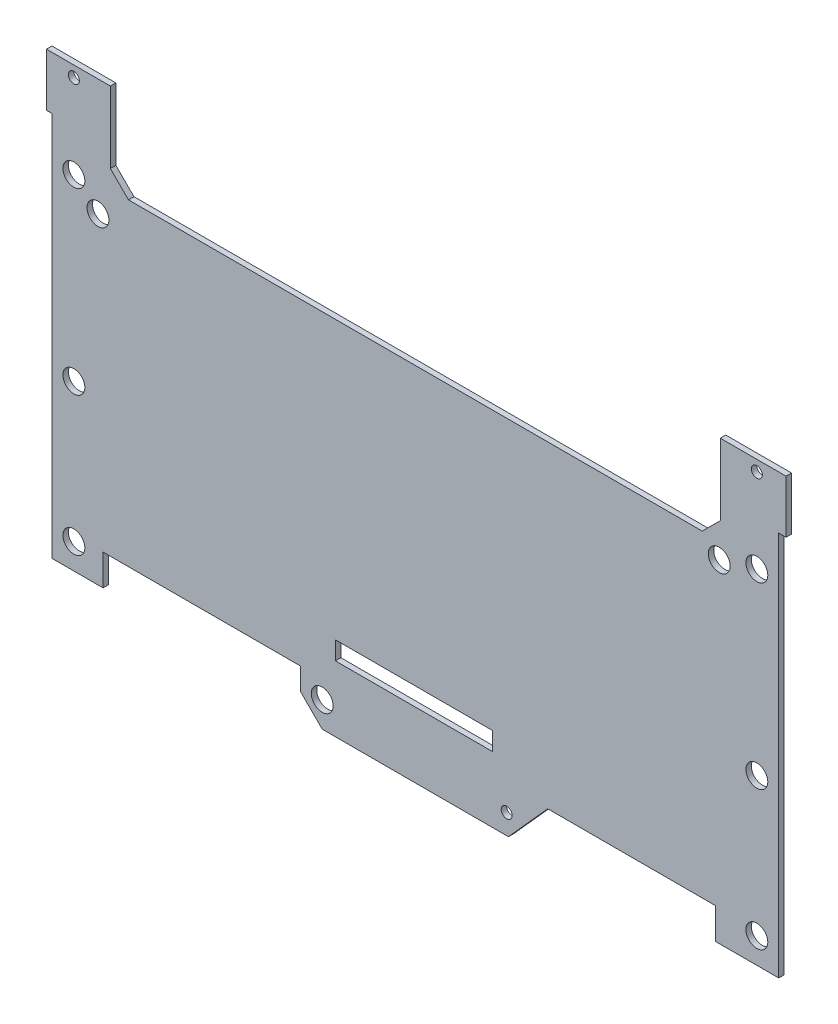
from build123d import *

# Parameters (mm, degrees)
SKETCH1_R           = 3
SKETCH1_R_2         = 1.5
SKETCH1_W           = 43
SKETCH1_H           = 5
BOSS_EXTRUDE1_DEPTH = 1.5


with BuildPart() as part:
    # Sketch1 → Boss-Extrude1 (new body)
    with BuildSketch(Plane.XY):
        Polygon((-100.6, 103), (-83.1, 103), (-83.1, 83.449747468), (-78.150252532, 78.5), (78.950252532, 78.5), (83.9, 83.449747468), (83.9, 103), (101.9, 103), (101.9, 88.5), (99.9, 88.5), (99.9, -17), (82.65, -17), (82.65, -8.5), (36.65, -8.5), (25.9, -20.5), (-25.1, -20.5), (-31.1, -14.5), (-31.1, -8.5), (-85.1, -8.5), (-85.1, -17), (-99.1, -17), (-99.1, 88.5), (-100.6, 88.5), align=None)
        with Locations((93.9, 77)):
            Circle(SKETCH1_R, mode=Mode.SUBTRACT)
        with Locations((83.6, 74)):
            Circle(SKETCH1_R, mode=Mode.SUBTRACT)
        with Locations((93.9, -10)):
            Circle(SKETCH1_R, mode=Mode.SUBTRACT)
        with Locations((93.9, 28)):
            Circle(SKETCH1_R, mode=Mode.SUBTRACT)
        with Locations((93.9, 100)):
            Circle(SKETCH1_R_2, mode=Mode.SUBTRACT)
        with Locations((25.4, -15)):
            Circle(SKETCH1_R_2, mode=Mode.SUBTRACT)
        with Locations((-25.1, -13.5)):
            Circle(SKETCH1_R, mode=Mode.SUBTRACT)
        with Locations((-93.1, -10)):
            Circle(SKETCH1_R, mode=Mode.SUBTRACT)
        with Locations((-93.1, 28)):
            Circle(SKETCH1_R, mode=Mode.SUBTRACT)
        with Locations((-93.1, 77)):
            Circle(SKETCH1_R, mode=Mode.SUBTRACT)
        with Locations((-86.5, 71)):
            Circle(SKETCH1_R, mode=Mode.SUBTRACT)
        with Locations((-93.1, 100)):
            Circle(SKETCH1_R_2, mode=Mode.SUBTRACT)
        Rectangle(SKETCH1_W, SKETCH1_H, mode=Mode.SUBTRACT)
    extrude(amount=BOSS_EXTRUDE1_DEPTH)


solid = part.part
